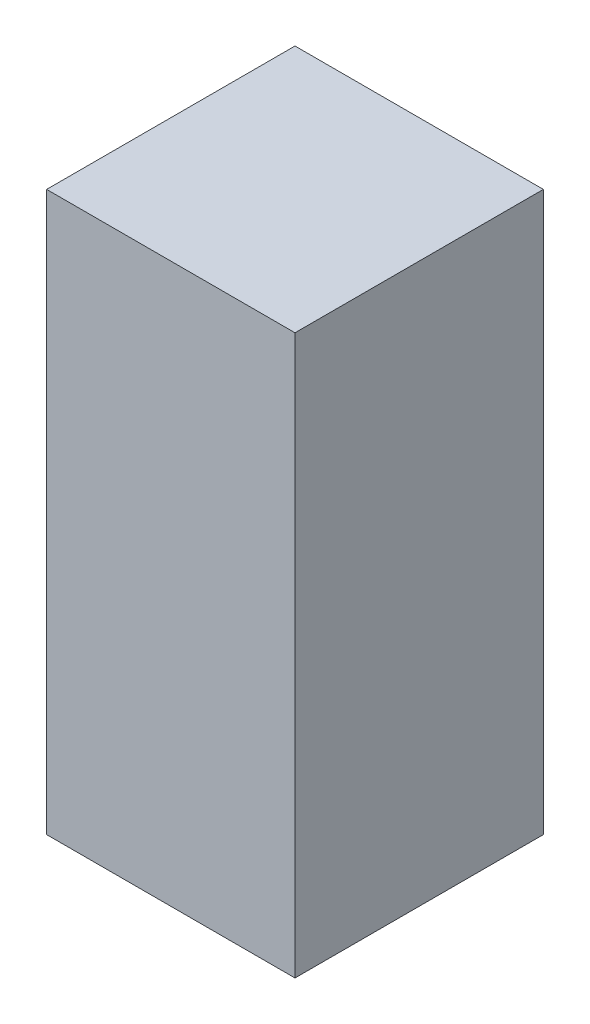
from build123d import *

# Parameters (mm, degrees)
SKETCH2_W           = 609.6
SKETCH2_H           = 609.6
BOSS_EXTRUDE1_DEPTH = 1371.6


with BuildPart() as part:
    # Sketch2 → Boss-Extrude1 (new body)
    with BuildSketch(Plane(origin=(0, 0, 0), x_dir=(1, 0, 0), z_dir=(0, 1, 0))):
        with Locations((304.8, 304.8)):
            Rectangle(SKETCH2_W, SKETCH2_H)
    extrude(amount=BOSS_EXTRUDE1_DEPTH)


solid = part.part
